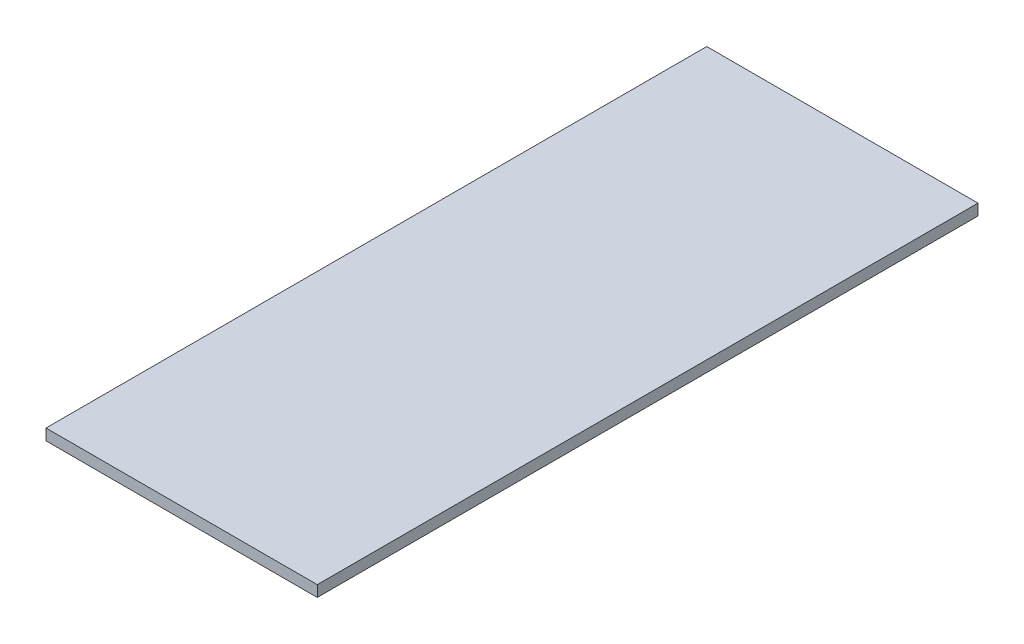
from build123d import *

# Parameters (mm, degrees)
SKETCH_1_W      = 39
SKETCH_1_H      = 95
EXTRUDE_1_DEPTH = 1.6


with BuildPart() as part:
    # 草图1 → 凸台-拉伸1 (new body)
    with BuildSketch(Plane(origin=(0, 0, 0), x_dir=(1, 0, 0), z_dir=(0, 1, 0))):
        with Locations((19.5, 47.5)):
            Rectangle(SKETCH_1_W, SKETCH_1_H)
    extrude(amount=EXTRUDE_1_DEPTH)


solid = part.part
